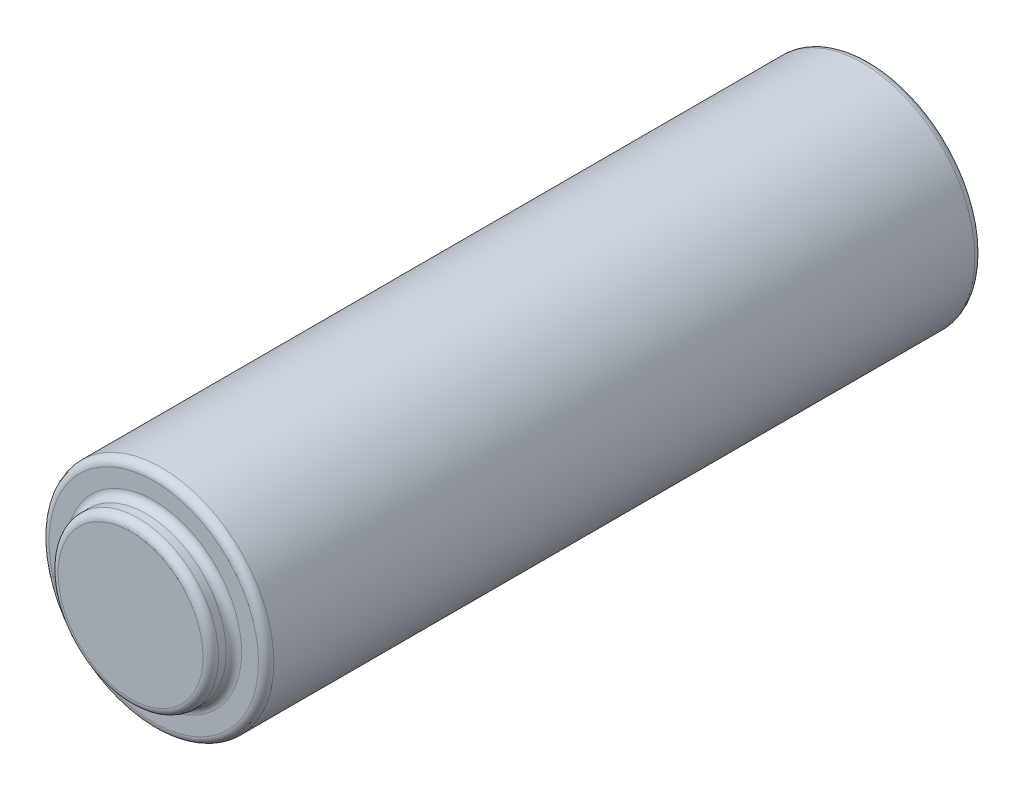
from build123d import *

# Parameters (mm, degrees)
SKETCH1_R           = 7.400445615
BOSS_EXTRUDE1_DEPTH = 47.157501005
SKETCH2_R           = 5.279749884
BOSS_EXTRUDE2_DEPTH = 1.524
FILLET1_R           = 0.508
FILLET2_R           = 0.508
FILLET3_R           = 0.508


with BuildPart() as part:
    # Sketch1 → Boss-Extrude1 (new body)
    with BuildSketch(Plane.XY):
        with Locations((23.495, 8.89)):
            Circle(SKETCH1_R)
    extrude(amount=BOSS_EXTRUDE1_DEPTH)

    # Sketch2 → Boss-Extrude2 (add)
    with BuildSketch(Plane.XY.offset(47.157501005)):
        with Locations(Location((23.495, 8.89, 0), (0, 0, 180))):
            Circle(SKETCH2_R)
    extrude(amount=BOSS_EXTRUDE2_DEPTH)

    # Fillet1
    fillet1_edges = [part.edges().sort_by_distance(p)[0] for p in [
        (28.774749884, 8.89, 48.681501005),
    ]]
    fillet(fillet1_edges, radius=FILLET1_R)

    # Fillet2
    fillet2_edges = [part.edges().sort_by_distance(p)[0] for p in [
        (16.094554385, 8.89, 47.157501005),
        (28.774749884, 8.89, 47.157501005),
    ]]
    fillet(fillet2_edges, radius=FILLET2_R)

    # Fillet3
    fillet3_edges = [part.edges().sort_by_distance(p)[0] for p in [
        (16.094554385, 8.89, 0),
    ]]
    fillet(fillet3_edges, radius=FILLET3_R)


solid = part.part
